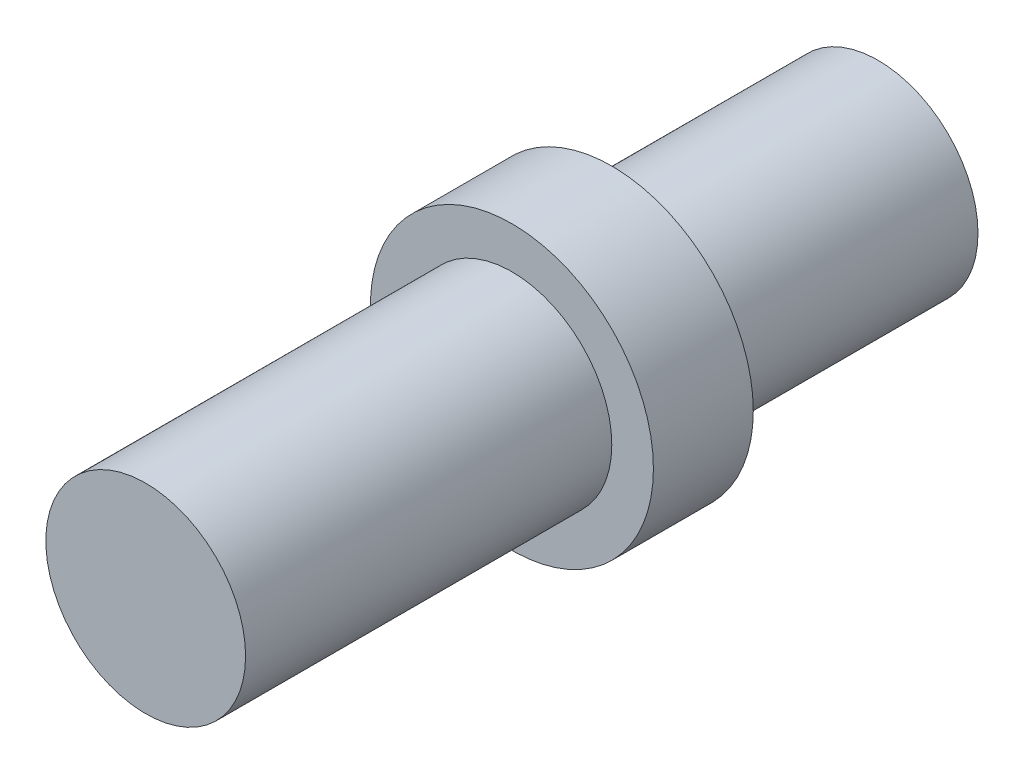
from build123d import *

# Parameters (mm, degrees)
SKETCH_1_R      = 6
EXTRUDE_1_DEPTH = 44
EXTRUDE_START   = 16
SKETCH_2_R      = 8.5
EXTRUDE_2_DEPTH = 6


with BuildPart() as part:
    # 草图1 → 凸台-拉伸1 (new body)
    with BuildSketch(Plane.XY):
        Circle(SKETCH_1_R)
    extrude(amount=EXTRUDE_1_DEPTH)

    # 草图2 → 凸台-拉伸2 (add)
    with BuildSketch(Plane.XY.offset(EXTRUDE_START)):
        Circle(SKETCH_2_R)
    extrude(amount=EXTRUDE_2_DEPTH)


solid = part.part
